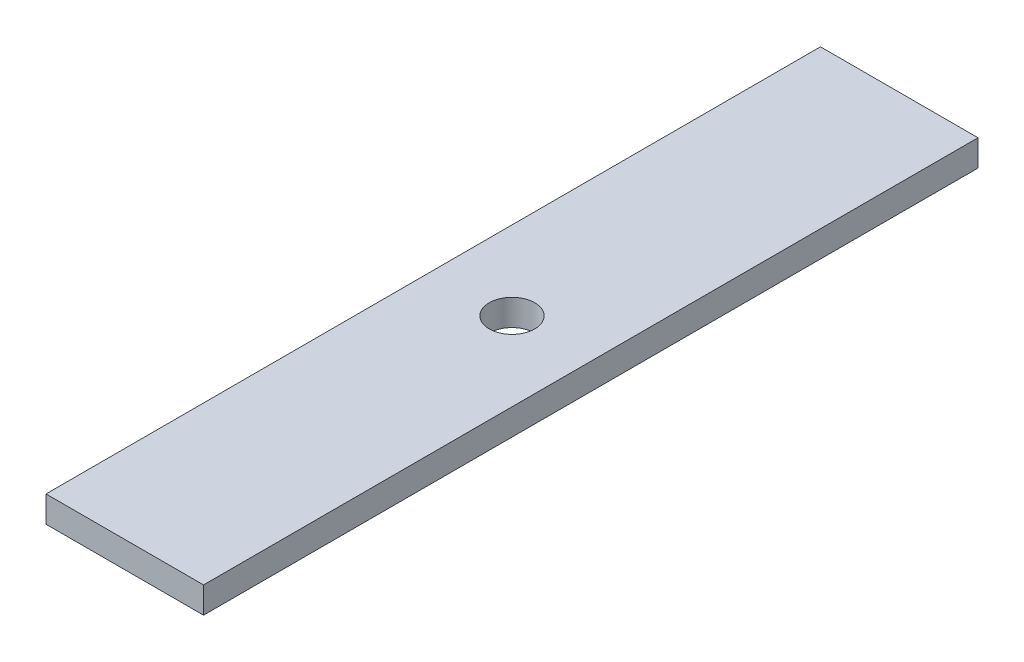
from build123d import *

# Parameters (mm, degrees)
SKETCH1_W           = 19.05
SKETCH1_H           = 3.175
BOSS_EXTRUDE1_DEPTH = 93.65
SKETCH2_R           = 2.75
CUT_EXTRUDE1_DEPTH  = 10


with BuildPart() as part:
    # Sketch1 → Boss-Extrude1 (new body)
    with BuildSketch(Plane.XY):
        Rectangle(SKETCH1_W, SKETCH1_H)
    extrude(amount=BOSS_EXTRUDE1_DEPTH)

    # Sketch2 → Cut-Extrude1 (cut)
    with BuildSketch(Plane(origin=(0, 1.5875, 0), x_dir=(1, 0, 0), z_dir=(0, 1, 0))):
        with Locations(Location((0, -46.825, 0), (0, 0, 270))):
            Circle(SKETCH2_R)
    extrude(amount=-CUT_EXTRUDE1_DEPTH, mode=Mode.SUBTRACT)


solid = part.part
